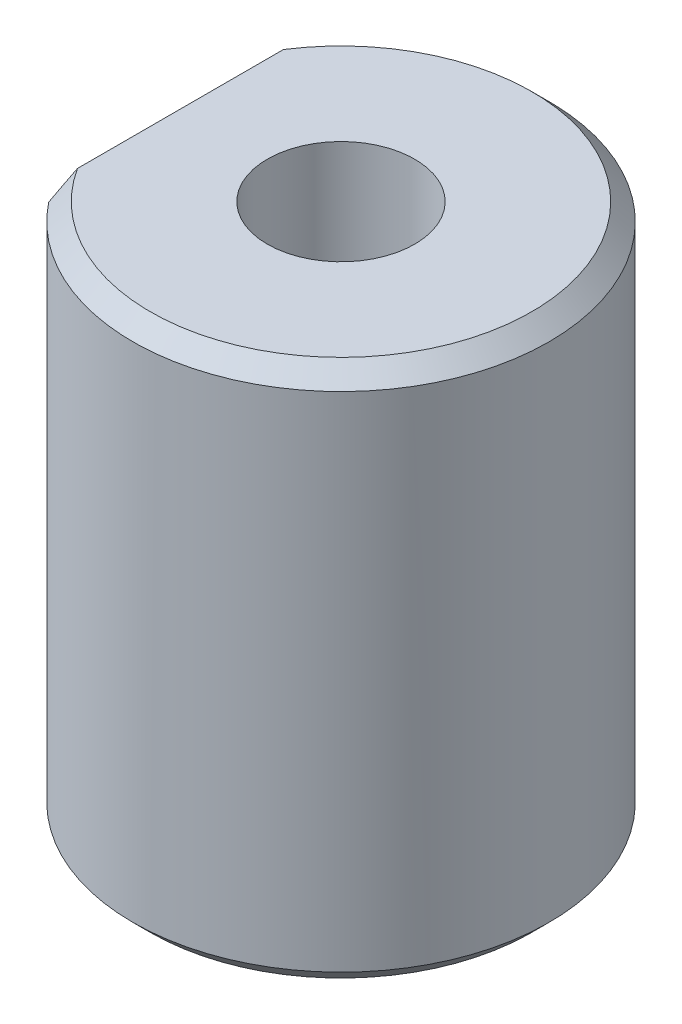
from build123d import *

# Parameters (mm, degrees)
SKETCH_1_R               = 12
EXTRUDE_1_DEPTH          = 31
HOLE_WIZARD_M10_1_D      = 8.5
CHAMFER_1_SIZE           = 1
CUT_EXTRUDE_1_DEPTH      = 36.341194094
CUT_EXTRUDE_1_DEPTH_BACK = 36.341194094
SKETCH_5_R               = 31


with BuildPart() as part:
    # 草图1 → 凸台-拉伸1 (new body)
    with BuildSketch(Plane(origin=(0, 0, 0), x_dir=(1, 0, 0), z_dir=(0, 1, 0))):
        with Locations(Location((0, 0, 0), (0, 0, 270))):
            Circle(SKETCH_1_R)
    extrude(amount=EXTRUDE_1_DEPTH)

    # M10 螺纹孔1 (through all)
    with Locations(Plane(origin=(0, 31, 0), x_dir=(1, 0, 0), z_dir=(0, 1, 0))):
        with Locations((0, 0)):
            Hole(HOLE_WIZARD_M10_1_D / 2)

    # 倒角1
    chamfer_1_edges = [part.edges().sort_by_distance(p)[0] for p in [
        (0, 0, -12),
        (0, 31, -12),
    ]]
    chamfer(chamfer_1_edges, length=CHAMFER_1_SIZE)

    # 草图5 → 切除-拉伸1 (cut, two sides: drawn at the far end of the back side and taken through both)
    with BuildSketch(Plane.XY.offset(-CUT_EXTRUDE_1_DEPTH_BACK)):
        with Locations((-40, 35)):
            Circle(SKETCH_5_R)
    extrude(amount=CUT_EXTRUDE_1_DEPTH + CUT_EXTRUDE_1_DEPTH_BACK, mode=Mode.SUBTRACT)


solid = part.part
